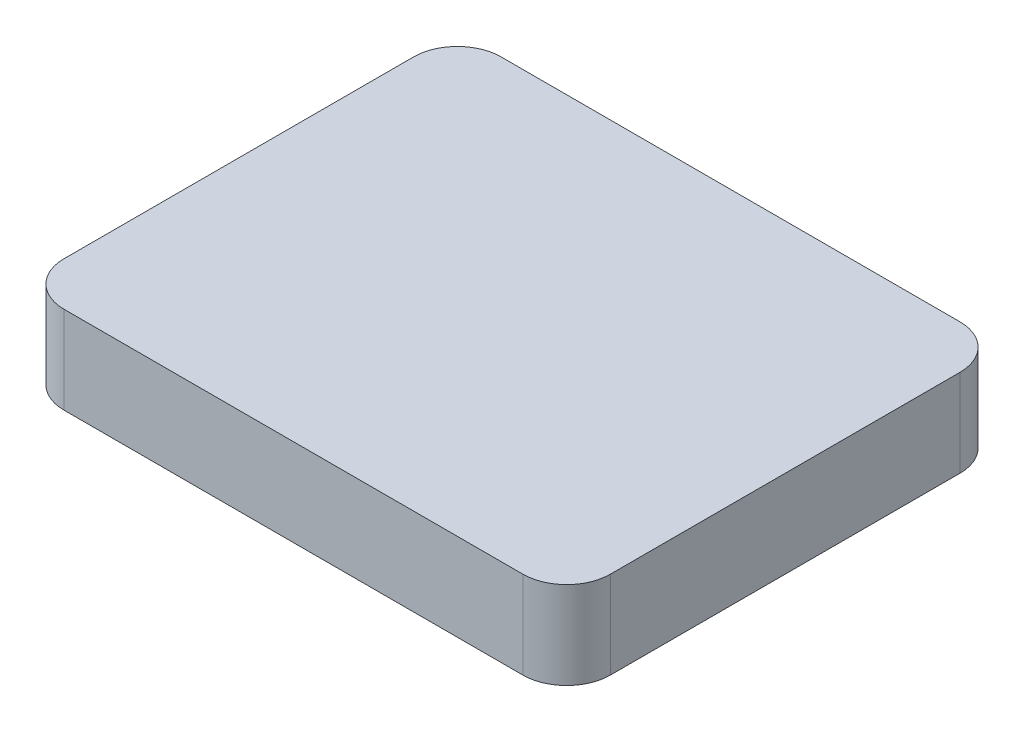
from build123d import *

# Parameters (mm, degrees)
BOSS_EXTRUDE1_DEPTH = 40


with BuildPart() as part:
    # Sketch1 → Boss-Extrude1 (new body)
    with BuildSketch(Plane(origin=(0, 0, 0), x_dir=(1, 0, 0), z_dir=(0, 1, 0))):
        with BuildLine():
            Line((-57.741597631, -115.978773585), (152.258402369, -115.978773585))
            ThreePointArc((152.258402369, -115.978773585), (166.400537992, -110.120909209), (172.258402369, -95.978773585))
            Line((172.258402369, -95.978773585), (172.258402369, 64.021226415))
            ThreePointArc((172.258402369, 64.021226415), (166.400537992, 78.163362039), (152.258402369, 84.021226415))
            Line((152.258402369, 84.021226415), (-57.741597631, 84.021226415))
            ThreePointArc((-57.741597631, 84.021226415), (-71.883733255, 78.163362039), (-77.741597631, 64.021226415))
            Line((-77.741597631, 64.021226415), (-77.741597631, -95.978773585))
            ThreePointArc((-77.741597631, -95.978773585), (-71.883733255, -110.120909209), (-57.741597631, -115.978773585))
        make_face()
    extrude(amount=BOSS_EXTRUDE1_DEPTH)


solid = part.part
